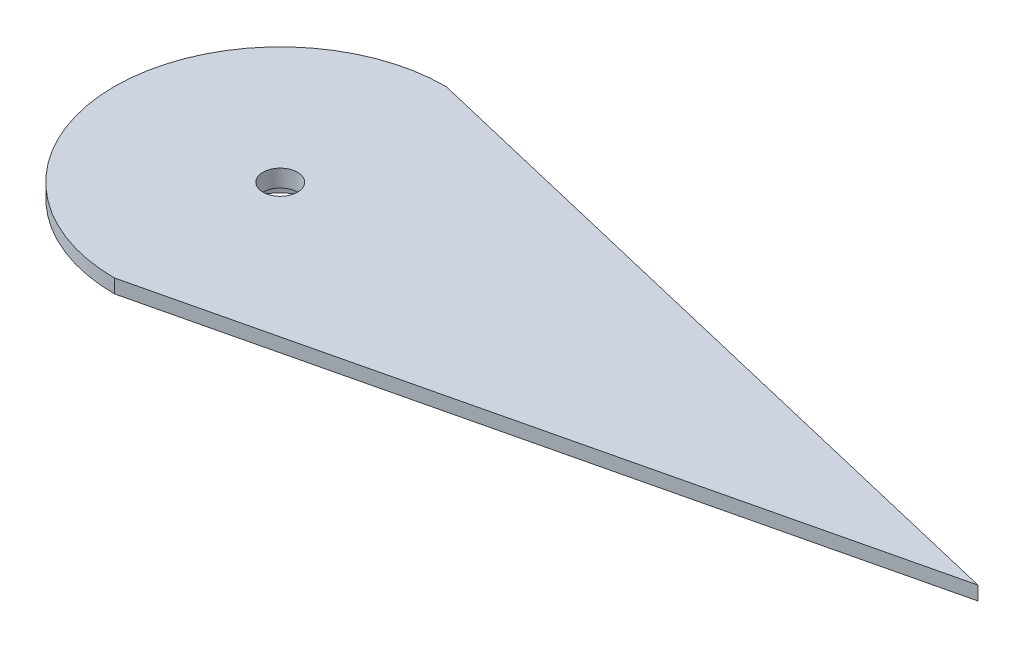
from build123d import *

# Parameters (mm, degrees)
BOSS_EXTRUDE1_DEPTH      = 2
SKETCH2_R                = 10
SKETCH2_R_2              = 8
BOSS_EXTRUDE2_DEPTH      = 5
SKETCH4_R                = 3.25
BOSS_EXTRUDE3_DEPTH      = 0.5
SKETCH5_R                = 2.5
CUT_EXTRUDE2_DEPTH       = 2.5
CUT_EXTRUDE3_DEPTH       = 5
FILLET1_R                = 0.5
CIRPATTERN5_COUNT        = 24
FILLET1_OF_CIRPATTERN5_R = 0.5


with BuildPart() as part:
    # Sketch1 → Boss-Extrude1 (new body)
    with BuildSketch(Plane(origin=(0, 0, 0), x_dir=(1, 0, 0), z_dir=(0, 1, 0))):
        with BuildLine():
            Line((0, 24), (101, 0))
            Line((101, 0), (0, -24))
            ThreePointArc((0, -24), (-24, 0), (0, 24))
        make_face()
    extrude(amount=BOSS_EXTRUDE1_DEPTH)

    # Sketch2 → Boss-Extrude2 (add)
    with BuildSketch(Plane.XZ):
        with Locations(Location((0, 0, 0), (0, 0, 270))):
            Circle(SKETCH2_R)
        with Locations(Location((0, 0, 0), (0, 0, 270))):
            Circle(SKETCH2_R_2, mode=Mode.SUBTRACT)
    extrude(amount=BOSS_EXTRUDE2_DEPTH)

    # Sketch4 → Boss-Extrude3 (add)
    with BuildSketch(Plane(origin=(0, 0, 0), x_dir=(-1, 0, 0), z_dir=(0, -1, 0))):
        with Locations(Location((0, 0, 0), (0, 0, 270))):
            Circle(SKETCH4_R)
    extrude(amount=BOSS_EXTRUDE3_DEPTH)

    # Sketch5 → Cut-Extrude2 (cut)
    with BuildSketch(Plane.XZ.offset(0.5)):
        with Locations(Location((0, 0, 0), (0, 0, 270))):
            Circle(SKETCH5_R)
    extrude(amount=-CUT_EXTRUDE2_DEPTH, mode=Mode.SUBTRACT)

    # Sketch6 → Cut-Extrude3 (cut)
    with BuildSketch(Plane.XZ.offset(5)):
        Polygon((-1, 11.817203407), (1, 11.817203407), (0.586202372, 8.817203407), (-0.586202372, 8.817203407), align=None)
    cut_extrude3 = extrude(amount=-CUT_EXTRUDE3_DEPTH, mode=Mode.SUBTRACT)

    # Fillet1
    fillet1_edges = [part.edges().sort_by_distance(p)[0] for p in [
        (0.745510128, -2.5, 9.972172013),
        (-0.745510128, -2.5, 9.972172013),
    ]]
    fillet(fillet1_edges, radius=FILLET1_R)

    # CirPattern5: Cut-Extrude3 ×24 about axis
    cirpattern5_axis = Axis((0, 0, 0), (0, 1, 0))
    for i in range(1, CIRPATTERN5_COUNT):
        add(cut_extrude3.rotate(cirpattern5_axis, i * 360 / CIRPATTERN5_COUNT), mode=Mode.SUBTRACT)

    # Fillet1 of CirPattern5
    fillet1_of_cirpattern5_edges = [part.edges().sort_by_distance(p)[0] for p in [
        (3.301095525, -2.5, 9.439426272),
        (1.860880551, -2.5, 9.825330711),
        (5.631716716, -2.5, 8.26339923),
        (4.340455296, -2.5, 9.008909358),
        (7.57854572, -2.5, 6.524235186),
        (6.524235186, -2.5, 7.57854572),
        (9.008909358, -2.5, 4.340455296),
        (8.26339923, -2.5, 5.631716716),
        (9.825330711, -2.5, 1.860880551),
        (9.439426272, -2.5, 3.301095525),
        (9.972172013, -2.5, -0.745510128),
        (9.972172013, -2.5, 0.745510128),
        (9.439426272, -2.5, -3.301095525),
        (9.825330711, -2.5, -1.860880551),
        (8.26339923, -2.5, -5.631716716),
        (9.008909358, -2.5, -4.340455296),
        (6.524235186, -2.5, -7.57854572),
        (7.57854572, -2.5, -6.524235186),
        (4.340455296, -2.5, -9.008909358),
        (5.631716716, -2.5, -8.26339923),
        (1.860880551, -2.5, -9.825330711),
        (3.301095525, -2.5, -9.439426272),
        (-0.745510128, -2.5, -9.972172013),
        (0.745510128, -2.5, -9.972172013),
        (-3.301095525, -2.5, -9.439426272),
        (-1.860880551, -2.5, -9.825330711),
        (-5.631716716, -2.5, -8.26339923),
        (-4.340455296, -2.5, -9.008909358),
        (-7.57854572, -2.5, -6.524235186),
        (-6.524235186, -2.5, -7.57854572),
        (-9.008909358, -2.5, -4.340455296),
        (-8.26339923, -2.5, -5.631716716),
        (-9.825330711, -2.5, -1.860880551),
        (-9.439426272, -2.5, -3.301095525),
        (-9.972172013, -2.5, 0.745510128),
        (-9.972172013, -2.5, -0.745510128),
        (-9.439426272, -2.5, 3.301095525),
        (-9.825330711, -2.5, 1.860880551),
        (-8.26339923, -2.5, 5.631716716),
        (-9.008909358, -2.5, 4.340455296),
        (-6.524235186, -2.5, 7.57854572),
        (-7.57854572, -2.5, 6.524235186),
        (-4.340455296, -2.5, 9.008909358),
        (-5.631716716, -2.5, 8.26339923),
        (-1.860880551, -2.5, 9.825330711),
        (-3.301095525, -2.5, 9.439426272),
    ]]
    fillet(fillet1_of_cirpattern5_edges, radius=FILLET1_OF_CIRPATTERN5_R)


solid = part.part
